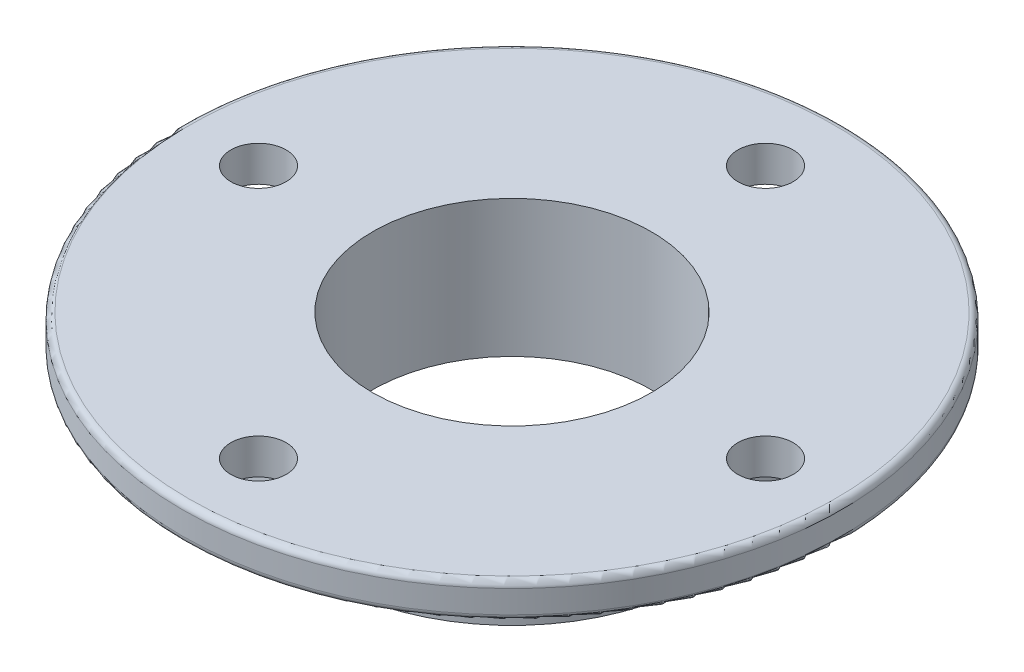
from build123d import *

# Parameters (mm, degrees)
SKETCH1_R           = 7.5
SKETCH1_R_2         = 5.5
BOSS_EXTRUDE1_DEPTH = 4
SKETCH2_R           = 13
SKETCH2_R_2         = 5.5
BOSS_EXTRUDE2_DEPTH = 1.4
SKETCH3_R           = 1.09
CUT_EXTRUDE1_DEPTH  = 20.161419572
CIRPATTERN1_COUNT   = 4
FILLET1_R           = 0.25


with BuildPart() as part:
    # Sketch1 → Boss-Extrude1 (new body)
    with BuildSketch(Plane(origin=(0, 0, 0), x_dir=(1, 0, 0), z_dir=(0, 1, 0))):
        with Locations(Location((0, 0, 0), (0, 0, 270))):
            Circle(SKETCH1_R)
        with Locations(Location((0, 0, 0), (0, 0, 270))):
            Circle(SKETCH1_R_2, mode=Mode.SUBTRACT)
    extrude(amount=BOSS_EXTRUDE1_DEPTH)

    # Sketch2 → Boss-Extrude2 (add)
    with BuildSketch(Plane(origin=(0, 4, 0), x_dir=(1, 0, 0), z_dir=(0, 1, 0))):
        with Locations(Location((0, 0, 0), (0, 0, 270))):
            Circle(SKETCH2_R)
        with Locations(Location((0, 0, 0), (0, 0, 270))):
            Circle(SKETCH2_R_2, mode=Mode.SUBTRACT)
    extrude(amount=BOSS_EXTRUDE2_DEPTH)

    # Sketch3 → Cut-Extrude1 (cut, through all)
    with BuildSketch(Plane(origin=(0, 5.4, 0), x_dir=(1, 0, 0), z_dir=(0, 1, 0))):
        with Locations(Location((0, 10, 0), (0, 0, 270))):
            Circle(SKETCH3_R)
    cut_extrude1 = extrude(amount=-CUT_EXTRUDE1_DEPTH, mode=Mode.SUBTRACT)

    # CirPattern1: Cut-Extrude1 ×4 about axis
    cirpattern1_axis = Axis((0, 0, 0), (0, 1, 0))
    for i in range(1, CIRPATTERN1_COUNT):
        add(cut_extrude1.rotate(cirpattern1_axis, i * 360 / CIRPATTERN1_COUNT), mode=Mode.SUBTRACT)

    # Fillet1
    fillet1_edges = [part.edges().sort_by_distance(p)[0] for p in [
        (0, 4, -13),
        (0, 5.4, -13),
    ]]
    fillet(fillet1_edges, radius=FILLET1_R)


solid = part.part
